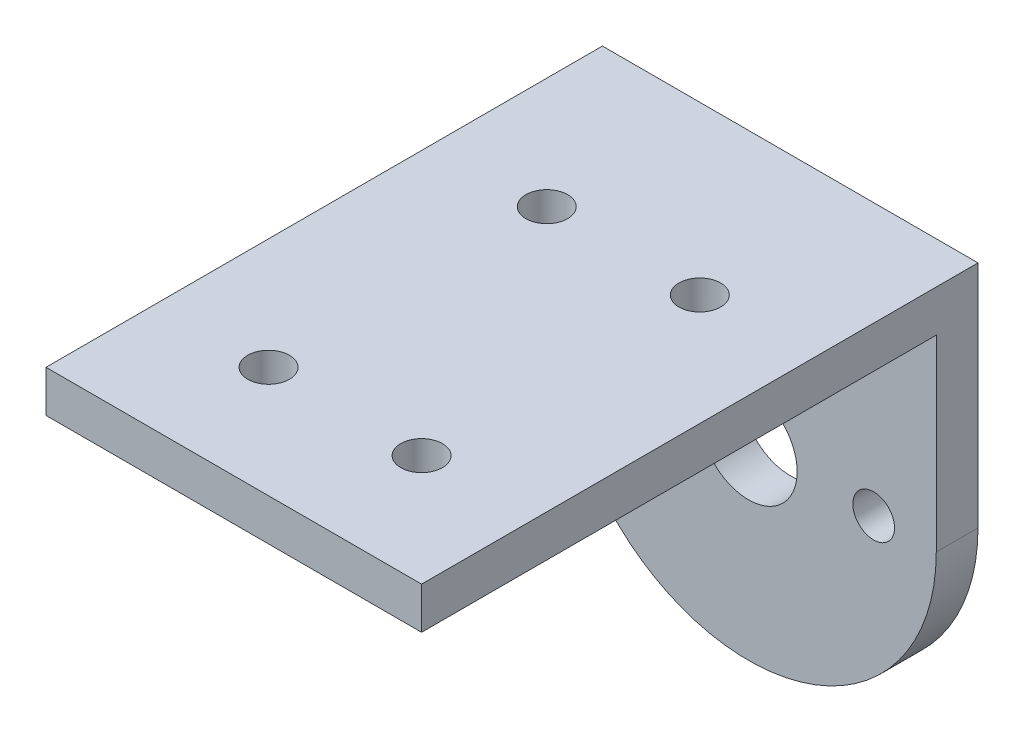
from build123d import *

# Parameters (mm, degrees)
MODEL_R             = 3.5
EXTRUDE_1_DEPTH     = 40
SKETCH_3_W          = 37
SKETCH_3_H          = 37
CUT_EXTRUDE_1_DEPTH = 36.778034896
SKETCH_4_R          = 1.5
CUT_EXTRUDE_2_DEPTH = 40
SKETCH1_R           = 1.5
CUT_EXTRUDE2_DEPTH  = 29


with BuildPart() as part:
    # Model → 凸台-拉伸1 (new body)
    with BuildSketch(Plane.XY):
        with BuildLine():
            Line((2619.766714505, 1592.826425633), (2619.766714505, 1609.326425633))
            Line((2619.766714505, 1609.326425633), (2592.766714505, 1609.326425633))
            Line((2592.766714505, 1609.326425633), (2592.766714505, 1592.826425633))
            ThreePointArc((2592.766714505, 1592.826425633), (2606.266714505, 1579.326425633), (2619.766714505, 1592.826425633))
        make_face()
        with Locations((2606.266714505, 1592.826425633)):
            Circle(MODEL_R, mode=Mode.SUBTRACT)
    extrude(amount=EXTRUDE_1_DEPTH)

    # 草图3 → 切除-拉伸1 (cut)
    with BuildSketch(Plane(origin=(2619.766714505, 0, 0), x_dir=(0, 0, -1), z_dir=(1, 0, 0))):
        with Locations((-21.5, 1587.826425633)):
            Rectangle(SKETCH_3_W, SKETCH_3_H)
    extrude(amount=-CUT_EXTRUDE_1_DEPTH, mode=Mode.SUBTRACT)

    # 草图4 → 切除-拉伸2 (cut)
    with BuildSketch(Plane(origin=(0, 1609.326425633, 0), x_dir=(1, 0, 0), z_dir=(0, 1, 0))):
        with Locations(Location((2600.766714505, -32, 0), (0, 0, 270))):
            Circle(SKETCH_4_R)
        with Locations(Location((2611.766714505, -32, 0), (0, 0, 270))):
            Circle(SKETCH_4_R)
        with Locations(Location((2600.766714505, -12, 0), (0, 0, 270))):
            Circle(SKETCH_4_R)
        with Locations(Location((2611.766714505, -12, 0), (0, 0, 270))):
            Circle(SKETCH_4_R)
    extrude(amount=-CUT_EXTRUDE_2_DEPTH, mode=Mode.SUBTRACT)

    # Sketch1 → Cut-Extrude2 (cut)
    with BuildSketch(Plane(origin=(0, 0, 0), x_dir=(-1, 0, 0), z_dir=(0, 0, -1))):
        with Locations((-2615.266714505, 1592.826425633)):
            Circle(SKETCH1_R)
        with Locations((-2597.266714505, 1592.826425633)):
            Circle(SKETCH1_R)
    extrude(amount=-CUT_EXTRUDE2_DEPTH, mode=Mode.SUBTRACT)


solid = part.part
